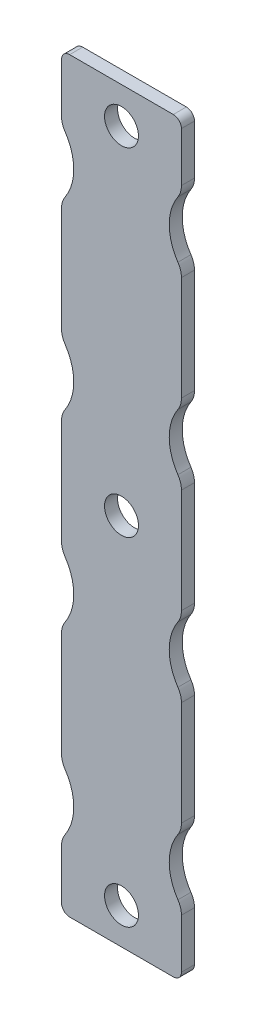
from build123d import *

# Parameters (mm, degrees)
SKETCH1_R           = 2.0828
BOSS_EXTRUDE1_DEPTH = 1.6
FILLET1_R           = 2.54
SKETCH3_R           = 2.0828
CUT_EXTRUDE1_DEPTH  = 79.362595117
SKETCH4_W           = 14.730000004
SKETCH4_H           = 1.456840112
BOSS_EXTRUDE2_DEPTH = 1.6
FILLET2_R           = 1


with BuildPart() as part:
    # Sketch1 → Boss-Extrude1 (new body)
    with BuildSketch(Plane.XY):
        with BuildLine():
            Line((7.903015948, 75.005885785), (22.633015952, 75.005885785))
            Line((22.633015952, 75.005885785), (22.633015952, 68.549399108))
            ThreePointArc((22.633015952, 68.549399108), (21.133015952, 64.505885785), (22.633015952, 60.462372462))
            Line((22.633015952, 60.462372462), (22.633015952, 45.943399108))
            ThreePointArc((22.633015952, 45.943399108), (21.133015952, 41.899885785), (22.633015952, 37.856372462))
            Line((22.633015952, 37.856372462), (22.633015952, 23.337399108))
            ThreePointArc((22.633015952, 23.337399108), (21.133015952, 19.293885785), (22.633015952, 15.250372462))
            Line((22.633015952, 15.250372462), (22.633015952, 0.731399108))
            ThreePointArc((22.633015952, 0.731399108), (21.133015952, -3.312114215), (22.633015952, -7.355627538))
            Line((22.633015952, -7.355627538), (22.633015952, -13.812114215))
            Line((22.633015952, -13.812114215), (7.903015948, -13.812114215))
            Line((7.903015948, -13.812114215), (7.903015948, -7.355627538))
            ThreePointArc((7.903015948, -7.355627538), (9.403015948, -3.312114215), (7.903015948, 0.731399108))
            Line((7.903015948, 0.731399108), (7.903015948, 15.250372462))
            ThreePointArc((7.903015948, 15.250372462), (9.403015948, 19.293885785), (7.903015948, 23.337399108))
            Line((7.903015948, 23.337399108), (7.903015948, 37.856372462))
            ThreePointArc((7.903015948, 37.856372462), (9.403015948, 41.899885785), (7.903015948, 45.943399108))
            Line((7.903015948, 45.943399108), (7.903015948, 60.462372462))
            ThreePointArc((7.903015948, 60.462372462), (9.403015948, 64.505885785), (7.903015948, 68.549399108))
            Line((7.903015948, 68.549399108), (7.903015948, 75.005885785))
        make_face()
        with Locations((15.26801595, 72.043125897)):
            Circle(SKETCH1_R, mode=Mode.SUBTRACT)
        with Locations(Location((15.26801595, -10.849354327, 0), (0, 0, 180))):
            Circle(SKETCH1_R, mode=Mode.SUBTRACT)
    extrude(amount=BOSS_EXTRUDE1_DEPTH)

    # Fillet1
    fillet1_edges = [part.edges().sort_by_distance(p)[0] for p in [
        (22.633015952, 68.549399108, 0.8),
        (22.633015952, 60.462372462, 0.8),
        (22.633015952, 45.943399108, 0.8),
        (22.633015952, 37.856372462, 0.8),
        (22.633015952, 23.337399108, 0.8),
        (22.633015952, 15.250372462, 0.8),
        (22.633015952, 0.731399108, 0.8),
        (22.633015952, -7.355627538, 0.8),
        (7.903015948, -7.355627538, 0.8),
        (7.903015948, 0.731399108, 0.8),
        (7.903015948, 15.250372462, 0.8),
        (7.903015948, 23.337399108, 0.8),
        (7.903015948, 37.856372462, 0.8),
        (7.903015948, 45.943399108, 0.8),
        (7.903015948, 60.462372462, 0.8),
        (7.903015948, 68.549399108, 0.8),
    ]]
    fillet(fillet1_edges, radius=FILLET1_R)

    # Sketch3 → Cut-Extrude1 (cut, through all)
    with BuildSketch(Plane.XY.offset(1.6)):
        with Locations((15.26801595, 30.596885785)):
            Circle(SKETCH3_R)
    extrude(amount=-CUT_EXTRUDE1_DEPTH, mode=Mode.SUBTRACT)

    # Sketch4 → Boss-Extrude2 (add, through all)
    with BuildSketch(Plane.XY.offset(1.6)):
        with Locations((15.26801595, -14.540534271)):
            Rectangle(SKETCH4_W, SKETCH4_H)
        with Locations((15.26801595, 75.734305841)):
            Rectangle(SKETCH4_W, SKETCH4_H)
    extrude(amount=-BOSS_EXTRUDE2_DEPTH)

    # Fillet2
    fillet2_edges = [part.edges().sort_by_distance(p)[0] for p in [
        (7.903015948, 76.462725897, 0.8),
        (22.633015952, 76.462725897, 0.8),
        (7.903015948, -15.268954327, 0.8),
        (22.633015952, -15.268954327, 0.8),
    ]]
    fillet(fillet2_edges, radius=FILLET2_R)


solid = part.part
